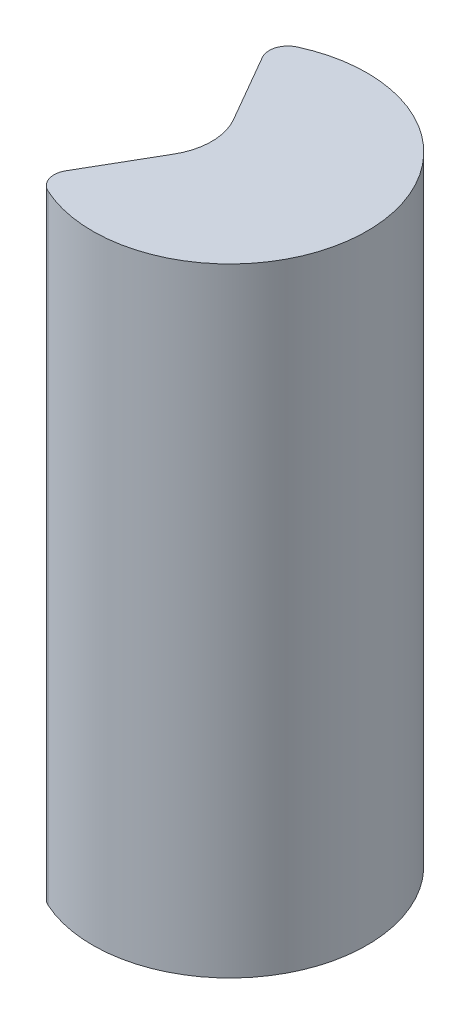
from build123d import *

# Parameters (mm, degrees)
BOSS_EXTRUDE1_DEPTH = 330


with BuildPart() as part:
    # Sketch1 → Boss-Extrude1 (new body)
    with BuildSketch(Plane(origin=(0, 0, 0), x_dir=(1, 0, 0), z_dir=(0, 1, 0))):
        with BuildLine():
            Line((-13.95369343, 15.875), (-35.055377431, 52.424188815))
            ThreePointArc((-35.055377431, 52.424188815), (-35.924016074, 60.457372666), (-30.571566968, 66.51029464))
            ThreePointArc((-30.571566968, 66.51029464), (73.2, 0), (-30.571566968, -66.51029464))
            ThreePointArc((-30.571566968, -66.51029464), (-35.924016074, -60.457372666), (-35.055377431, -52.424188815))
            Line((-35.055377431, -52.424188815), (-13.95369343, -15.875))
            ThreePointArc((-13.95369343, -15.875), (-9.7, 0), (-13.95369343, 15.875))
        make_face()
    extrude(amount=BOSS_EXTRUDE1_DEPTH)


solid = part.part
